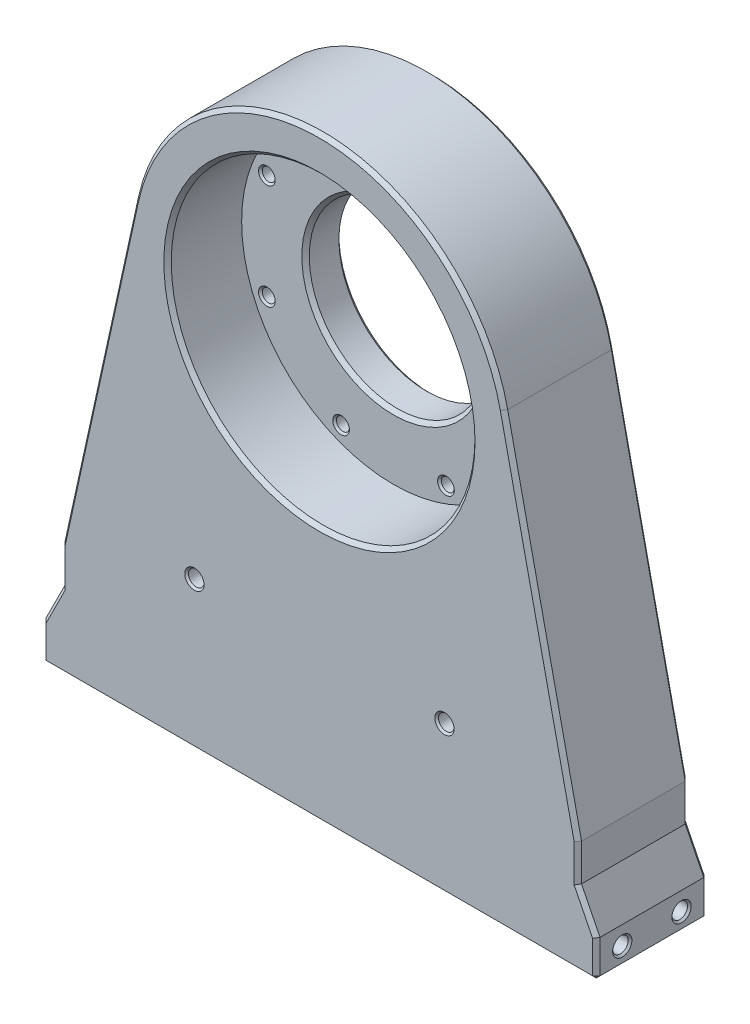
from build123d import *

# Parameters (mm, degrees)
SKETCH_1_W          = 149.5
SKETCH_1_H          = 165
EXTRUDE_1_DEPTH     = 30
CUT_EXTRUDE_1_DEPTH = 116.298796611
SKETCH_3_R          = 41
CUT_EXTRUDE_2_DEPTH = 20
SKETCH_4_R          = 23.75
CUT_EXTRUDE_3_DEPTH = 114.109736539
SKETCH_5_R          = 1.75
CUT_EXTRUDE_4_DEPTH = 116.298796611
SKETCH_6_R          = 3.1
CUT_EXTRUDE_5_DEPTH = 4
SKETCH_7_R          = 2.1
CUT_EXTRUDE_6_DEPTH = 8
CHAMFER_1_SIZE      = 0.5
CHAMFER_2_SIZE      = 1
CHAMFER_3_SIZE      = 0.5
CUT_EXTRUDE_7_DEPTH = 116.298796611
CHAMFER_4_SIZE      = 1
SKETCH_9_R          = 2.1
CUT_EXTRUDE_8_DEPTH = 8
CHAMFER_5_SIZE      = 0.5


with BuildPart() as part:
    # 草图1 → 凸台-拉伸1 (new body)
    with BuildSketch(Plane.XY):
        Rectangle(SKETCH_1_W, SKETCH_1_H)
    extrude(amount=EXTRUDE_1_DEPTH)

    # 草图2 → 切除-拉伸1 (cut, through all)
    with BuildSketch(Plane.XY.offset(30)):
        Polygon((-74.75, 82.5), (-74.75, -72.5), (-69.75, -62.5), (-69.75, 82.5), align=None)
        Polygon((69.75, 82.5), (74.75, 82.5), (74.75, -72.5), (69.75, -62.5), align=None)
    extrude(amount=-CUT_EXTRUDE_1_DEPTH, mode=Mode.SUBTRACT)

    # 草图3 → 切除-拉伸2 (cut)
    with BuildSketch(Plane.XY.offset(30)):
        with Locations((0, 27.5)):
            Circle(SKETCH_3_R)
    extrude(amount=-CUT_EXTRUDE_2_DEPTH, mode=Mode.SUBTRACT)

    # 草图4 → 切除-拉伸3 (cut, through all)
    with BuildSketch(Plane.XY.offset(10)):
        with Locations((0, 27.5)):
            Circle(SKETCH_4_R)
    extrude(amount=-CUT_EXTRUDE_3_DEPTH, mode=Mode.SUBTRACT)

    # 草图5 → 切除-拉伸4 (cut, through all)
    with BuildSketch(Plane(origin=(0, 0, 0), x_dir=(-1, 0, 0), z_dir=(0, 0, -1))):
        with Locations((14.159286998, 61.683542703)):
            Circle(SKETCH_5_R)
        with Locations((34.183542703, 41.659286998)):
            Circle(SKETCH_5_R)
        with Locations((34.183542703, 13.340713002)):
            Circle(SKETCH_5_R)
        with Locations((14.159286998, -6.683542703)):
            Circle(SKETCH_5_R)
        with Locations((-14.159286998, -6.683542703)):
            Circle(SKETCH_5_R)
        with Locations((-34.183542703, 13.340713002)):
            Circle(SKETCH_5_R)
        with Locations((-34.183542703, 41.659286998)):
            Circle(SKETCH_5_R)
        with Locations((-14.159286998, 61.683542703)):
            Circle(SKETCH_5_R)
    extrude(amount=-CUT_EXTRUDE_4_DEPTH, mode=Mode.SUBTRACT)

    # 草图6 → 切除-拉伸5 (cut)
    with BuildSketch(Plane(origin=(0, 0, 0), x_dir=(-1, 0, 0), z_dir=(0, 0, -1))):
        with Locations((14.159286998, 61.683542703)):
            Circle(SKETCH_6_R)
        with Locations((34.183542703, 41.659286998)):
            Circle(SKETCH_6_R)
        with Locations((34.183542703, 13.340713002)):
            Circle(SKETCH_6_R)
        with Locations((14.159286998, -6.683542703)):
            Circle(SKETCH_6_R)
        with Locations((-14.159286998, -6.683542703)):
            Circle(SKETCH_6_R)
        with Locations((-34.183542703, 13.340713002)):
            Circle(SKETCH_6_R)
        with Locations((-34.183542703, 41.659286998)):
            Circle(SKETCH_6_R)
        with Locations((-14.159286998, 61.683542703)):
            Circle(SKETCH_6_R)
    extrude(amount=-CUT_EXTRUDE_5_DEPTH, mode=Mode.SUBTRACT)

    # 草图7 → 切除-拉伸6 (cut)
    with BuildSketch(Plane(origin=(74.75, 0, 0), x_dir=(0, 0, -1), z_dir=(1, 0, 0))):
        with Locations(Location((-23, -77.5, 0), (0, 0, 90))):
            Circle(SKETCH_7_R)
        with Locations(Location((-7, -77.5, 0), (0, 0, 270))):
            Circle(SKETCH_7_R)
    cut_extrude_6 = extrude(amount=-CUT_EXTRUDE_6_DEPTH, mode=Mode.SUBTRACT)

    # 镜向1: 切除-拉伸6 across plane
    add(cut_extrude_6.mirror(Plane(origin=(0, 0, 0), x_dir=(0, 0, 1), z_dir=(1, 0, 0))), mode=Mode.SUBTRACT)

    # 倒角1
    chamfer_1_edges = [part.edges().sort_by_distance(p)[0] for p in [
        (74.75, -79.6, 23),
        (74.75, -75.4, 7),
        (-74.75, -79.6, 23),
        (-74.75, -75.4, 7),
    ]]
    chamfer(chamfer_1_edges, length=CHAMFER_1_SIZE)

    # 倒角2
    chamfer_2_edges = [part.edges().sort_by_distance(p)[0] for p in [
        (-41, 27.5, 30),
        (-23.75, 27.5, 0),
        (-23.75, 27.5, 10),
    ]]
    chamfer(chamfer_2_edges, length=CHAMFER_2_SIZE)

    # 倒角3
    chamfer_3_edges = [part.edges().sort_by_distance(p)[0] for p in [
        (-32.433542703, 41.659286998, 4),
        (-31.083542703, 41.659286998, 0),
        (-32.433542703, 13.340713002, 4),
        (-31.083542703, 13.340713002, 0),
        (-12.409286998, -6.683542703, 4),
        (-11.059286998, -6.683542703, 0),
        (15.909286998, -6.683542703, 4),
        (17.259286998, -6.683542703, 0),
        (35.933542703, 13.340713002, 4),
        (37.283542703, 13.340713002, 0),
        (35.933542703, 41.659286998, 4),
        (37.283542703, 41.659286998, 0),
        (15.909286998, 61.683542703, 4),
        (17.259286998, 61.683542703, 0),
        (-12.409286998, 61.683542703, 4),
        (-11.059286998, 61.683542703, 0),
        (-32.433542703, 41.659286998, 10),
        (-32.433542703, 13.340713002, 10),
        (-12.409286998, -6.683542703, 10),
        (15.909286998, -6.683542703, 10),
        (35.933542703, 13.340713002, 10),
        (35.933542703, 41.659286998, 10),
        (15.909286998, 61.683542703, 10),
        (-12.409286998, 61.683542703, 10),
    ]]
    chamfer(chamfer_3_edges, length=CHAMFER_3_SIZE)

    # 草图8 → 切除-拉伸7 (cut, through all)
    with BuildSketch(Plane.XY.offset(30)):
        with BuildLine():
            Line((-69.75, -52.5), (-49.816857163, 38.421572339))
            ThreePointArc((-49.816857163, 38.421572339), (0, 78.5), (49.816857163, 38.421572339))
            Line((49.816857163, 38.421572339), (69.75, -52.5))
            Line((69.75, -52.5), (69.75, 82.5))
            Line((69.75, 82.5), (-69.75, 82.5))
            Line((-69.75, 82.5), (-69.75, -52.5))
        make_face()
    extrude(amount=-CUT_EXTRUDE_7_DEPTH, mode=Mode.SUBTRACT)

    # 倒角4
    chamfer_4_edges = [part.edges().sort_by_distance(p)[0] for p in [
        (-74.75, -77.5, 0),
        (0, -82.5, 30),
        (-74.75, -77.5, 30),
        (-69.75, -57.5, 0),
        (-72.25, -67.5, 0),
        (-72.25, -67.5, 30),
        (-69.75, -57.5, 30),
        (69.75, -57.5, 30),
        (69.75, -57.5, 0),
        (59.783428582, -7.03921383, 0),
        (0, 78.5, 0),
        (-59.783428582, -7.03921383, 0),
        (-59.783428582, -7.03921383, 30),
        (0, 78.5, 30),
        (59.783428582, -7.03921383, 30),
        (72.25, -67.5, 0),
        (72.25, -67.5, 30),
        (74.75, -77.5, 30),
        (0, -82.5, 0),
        (74.75, -77.5, 0),
        (74.75, -82.5, 15),
        (-74.75, -82.5, 15),
    ]]
    chamfer(chamfer_4_edges, length=CHAMFER_4_SIZE)

    # 草图9 → 切除-拉伸8 (cut)
    with BuildSketch(Plane(origin=(0, 0, 30), x_dir=(-1, 0, 0), z_dir=(0, 0, -1))):
        with Locations((-33.75, -42.5)):
            Circle(SKETCH_9_R)
        with Locations((33.75, -42.5)):
            Circle(SKETCH_9_R)
    extrude(amount=CUT_EXTRUDE_8_DEPTH, mode=Mode.SUBTRACT)

    # 倒角5
    chamfer_5_edges = [part.edges().sort_by_distance(p)[0] for p in [
        (35.85, -42.5, 30),
        (-31.65, -42.5, 30),
    ]]
    chamfer(chamfer_5_edges, length=CHAMFER_5_SIZE)


solid = part.part
